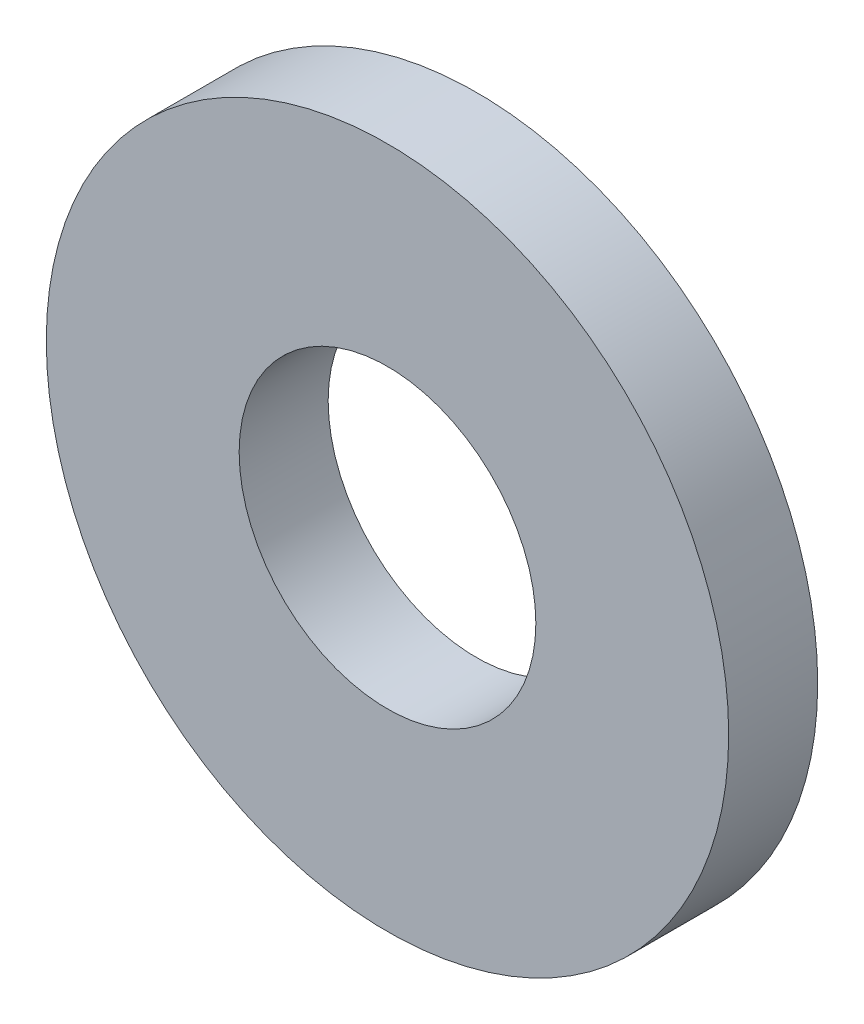
from build123d import *

# Parameters (mm, degrees)
SKETCH_1_R          = 11.5
SKETCH_1_R_2        = 2.65
EXTRUDE_1_DEPTH     = 2
SKETCH_2_R          = 11.5
EXTRUDE_2_DEPTH     = 1
SKETCH_3_R          = 5
CUT_EXTRUDE_1_DEPTH = 10


with BuildPart() as part:
    # 草图1 → 凸台-拉伸1 (new body)
    with BuildSketch(Plane.XY):
        Circle(SKETCH_1_R)
        with Locations((0, 8)):
            Circle(SKETCH_1_R_2, mode=Mode.SUBTRACT)
        with Locations((8, 0)):
            Circle(SKETCH_1_R_2, mode=Mode.SUBTRACT)
        with Locations(Location((0, -8, 0), (0, 0, 180))):
            Circle(SKETCH_1_R_2, mode=Mode.SUBTRACT)
        with Locations(Location((-8, 0, 0), (0, 0, 180))):
            Circle(SKETCH_1_R_2, mode=Mode.SUBTRACT)
    extrude(amount=EXTRUDE_1_DEPTH)

    # 草图2 → 凸台-拉伸2 (add)
    with BuildSketch(Plane.XY.offset(2)):
        Circle(SKETCH_2_R)
    extrude(amount=EXTRUDE_2_DEPTH)

    # 草图3 → 切除-拉伸1 (cut)
    with BuildSketch(Plane.XY.offset(3)):
        Circle(SKETCH_3_R)
    extrude(amount=-CUT_EXTRUDE_1_DEPTH, mode=Mode.SUBTRACT)


solid = part.part
